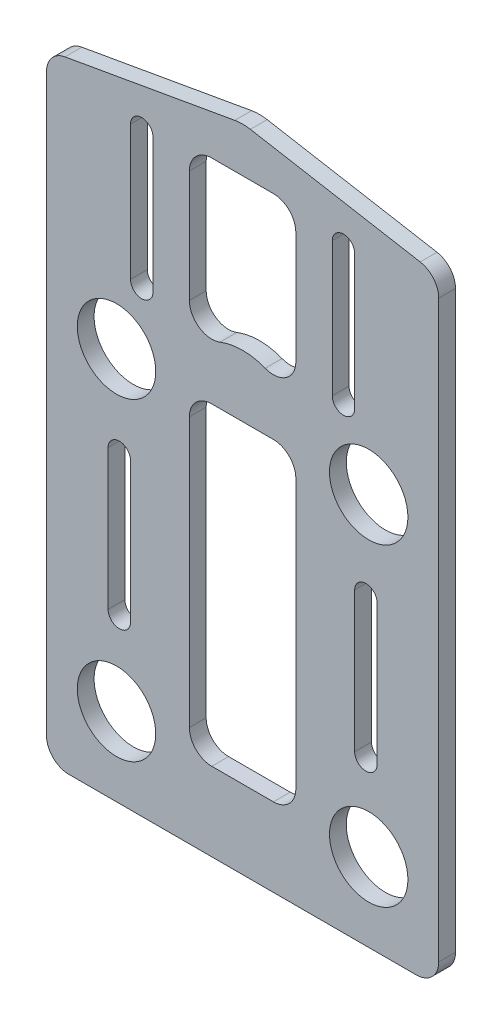
from build123d import *

# Parameters (mm, degrees)
SKETCH1_R           = 3.5
BOSS_EXTRUDE1_DEPTH = 1.5


with BuildPart() as part:
    # Sketch1 → Boss-Extrude1 (new body)
    with BuildSketch(Plane(origin=(0, 0, 0), x_dir=(-1, 0, 0), z_dir=(0, 0, -1))):
        with BuildLine():
            Line((15.847296355, 27.779408386), (0.694592711, 30.451238869))
            ThreePointArc((0.694592711, 30.451238869), (0, 30.512007857), (-0.694592711, 30.451238869))
            Line((-0.694592711, 30.451238869), (-15.847296355, 27.779408386))
            ThreePointArc((-15.847296355, 27.779408386), (-17.032088886, 27.0953681), (-17.5, 25.80979288))
            Line((-17.5, 25.80979288), (-17.5, -25.487992143))
            ThreePointArc((-17.5, -25.487992143), (-16.914213562, -26.902205705), (-15.5, -27.487992143))
            Line((-15.5, -27.487992143), (15.5, -27.487992143))
            ThreePointArc((15.5, -27.487992143), (16.914213562, -26.902205705), (17.5, -25.487992143))
            Line((17.5, -25.487992143), (17.5, 25.80979288))
            ThreePointArc((17.5, 25.80979288), (17.032088886, 27.0953681), (15.847296355, 27.779408386))
        make_face()
        with Locations(Location((11.25, 7.512007857, 0), (0, 0, 180))):
            Circle(SKETCH1_R, mode=Mode.SUBTRACT)
        with Locations(Location((11.25, -20.487992143, 0), (0, 0, 180))):
            Circle(SKETCH1_R, mode=Mode.SUBTRACT)
        with Locations(Location((-11.25, -20.487992143, 0), (0, 0, 180))):
            Circle(SKETCH1_R, mode=Mode.SUBTRACT)
        with Locations(Location((-11.25, 7.512007857, 0), (0, 0, 180))):
            Circle(SKETCH1_R, mode=Mode.SUBTRACT)
        with BuildLine():
            Line((-4.75, 14.512007857), (-4.75, 24.512007857))
            ThreePointArc((-4.75, 24.512007857), (-4.164213562, 25.92622142), (-2.75, 26.512007857))
            Line((-2.75, 26.512007857), (2.75, 26.512007857))
            ThreePointArc((2.75, 26.512007857), (4.164213562, 25.92622142), (4.75, 24.512007857))
            Line((4.75, 24.512007857), (4.75, 14.512007857))
            ThreePointArc((4.75, 14.512007857), (3.875930191, 12.859046513), (2.017718795, 12.650888776))
            ThreePointArc((2.017718795, 12.650888776), (0, 13.033559582), (-2.017718795, 12.650888776))
            ThreePointArc((-2.017718795, 12.650888776), (-3.875930191, 12.859046513), (-4.75, 14.512007857))
        make_face(mode=Mode.SUBTRACT)
        with BuildLine():
            Line((4.75, 5.512007857), (4.75, -18.487992143))
            ThreePointArc((4.75, -18.487992143), (4.164213562, -19.902205705), (2.75, -20.487992143))
            Line((2.75, -20.487992143), (-2.75, -20.487992143))
            ThreePointArc((-2.75, -20.487992143), (-4.164213562, -19.902205705), (-4.75, -18.487992143))
            Line((-4.75, -18.487992143), (-4.75, 5.512007857))
            ThreePointArc((-4.75, 5.512007857), (-4.164213562, 6.92622142), (-2.75, 7.512007857))
            Line((-2.75, 7.512007857), (2.75, 7.512007857))
            ThreePointArc((2.75, 7.512007857), (4.164213562, 6.92622142), (4.75, 5.512007857))
        make_face(mode=Mode.SUBTRACT)
        with BuildLine():
            Line((12, -0.487992143), (12, -12.987992143))
            ThreePointArc((12, -12.987992143), (11, -13.987992143), (10, -12.987992143))
            Line((10, -12.987992143), (10, -0.487992143))
            ThreePointArc((10, -0.487992143), (11, 0.512007857), (12, -0.487992143))
        make_face(mode=Mode.SUBTRACT)
        with BuildLine():
            Line((10, 25.512007857), (10, 13.512007857))
            ThreePointArc((10, 13.512007857), (9, 12.512007857), (8, 13.512007857))
            Line((8, 13.512007857), (8, 25.512007857))
            ThreePointArc((8, 25.512007857), (9, 26.512007857), (10, 25.512007857))
        make_face(mode=Mode.SUBTRACT)
        with BuildLine():
            Line((-10, -0.487992143), (-10, -12.987992143))
            ThreePointArc((-10, -12.987992143), (-11, -13.987992143), (-12, -12.987992143))
            Line((-12, -12.987992143), (-12, -0.487992143))
            ThreePointArc((-12, -0.487992143), (-11, 0.512007857), (-10, -0.487992143))
        make_face(mode=Mode.SUBTRACT)
        with BuildLine():
            Line((-8, 25.512007857), (-8, 13.512007857))
            ThreePointArc((-8, 13.512007857), (-9, 12.512007857), (-10, 13.512007857))
            Line((-10, 13.512007857), (-10, 25.512007857))
            ThreePointArc((-10, 25.512007857), (-9, 26.512007857), (-8, 25.512007857))
        make_face(mode=Mode.SUBTRACT)
    extrude(amount=-BOSS_EXTRUDE1_DEPTH)


solid = part.part
